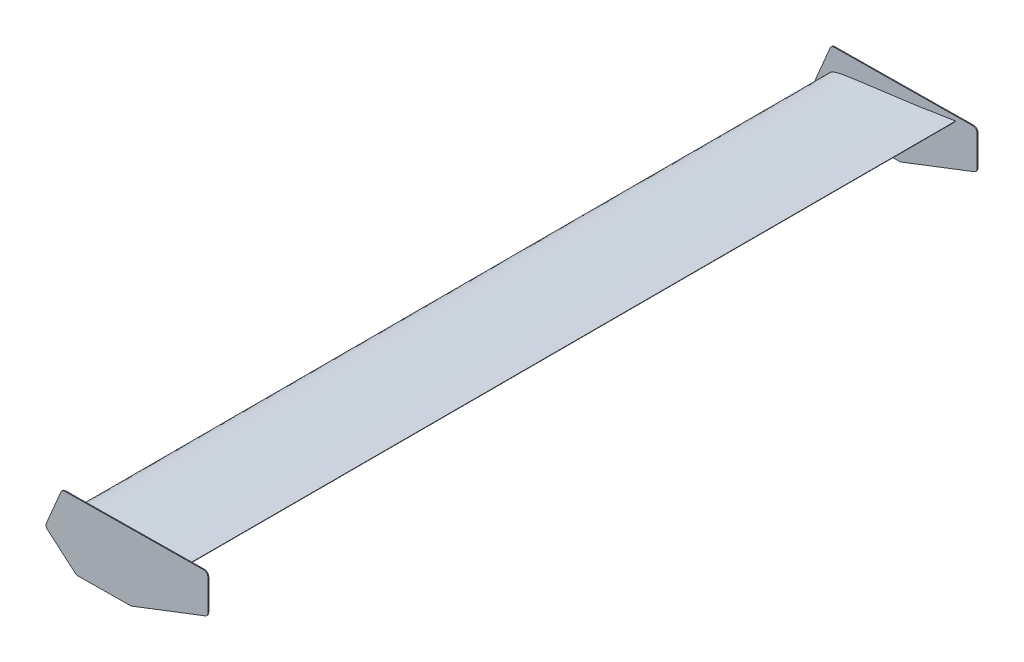
from build123d import *

# Parameters (mm, degrees)
REAR_WING_DEPTH              = 900
ENDPLATE_DEPTH               = 1
ENDPLATE_FILLET_R            = 10
ENDPLATE_FILLET_OF_MIRROR3_R = 10


with BuildPart() as part:
    # AirfoilSketch → Rear Wing (new, symmetric)
    with BuildSketch(Plane.XY):
        with BuildLine():
            Line((295.442575552, 52.09449732), (295.577022422, 51.326171843))
            add(Edge.make_bspline(
                [(295.577022422, 51.326171843), (290.891307166, 49.125863165), (281.542489297, 44.735864208), (262.727569494, 36.435906063), (239.075022797, 26.764238403), (210.421609353, 16.296267249), (181.624153974, 6.78650927), (152.592609753, -1.48249307), (123.359896769, -8.586697214), (98.677588602, -12.925891398), (78.728820396, -15.011295498), (63.611934373, -15.80542888), (48.313855434, -15.752522226), (35.463538652, -14.718103531), (25.049621623, -13.224653078), (17.090309366, -11.487207724), (10.177698047, -9.311573144), (3.988918794, -6.34517133), (-1.90572151, -0.864008687), (2.417566099, 4.873248607), (7.36001883, 7.693238109), (13.417421507, 10.072827448), (20.72189235, 12.021947419), (30.503324848, 14.208402507), (42.829451238, 16.329747473), (57.68063797, 18.502286025), (72.586822119, 20.299113186), (92.448783551, 22.825093662), (117.277393969, 25.951179332), (147.028226768, 30.012914081), (176.791016388, 33.950396789), (206.524649131, 38.071154207), (236.212058613, 42.470007184), (260.908662249, 46.387409089), (280.654798818, 49.576550662), (290.51340536, 51.255196874), (295.442575552, 52.09449732)],
                knots=[0, 0, 0, 0, 0.025304886, 0.050487653, 0.100520433, 0.150190716, 0.199586607, 0.248740009, 0.297715539, 0.346600594, 0.371102737, 0.395726297, 0.420570145, 0.445825119, 0.458702216, 0.471919982, 0.485786003, 0.493461051, 0.506863029, 0.51614777, 0.522766003, 0.535269014, 0.547551134, 0.559786371, 0.584228898, 0.60868081, 0.633151284, 0.657621757, 0.706558114, 0.75548187, 0.804405627, 0.853320224, 0.902221408, 0.951113136, 0.975557228, 1, 1, 1, 1], degree=3))
        make_face()
    extrude(amount=REAR_WING_DEPTH, both=True)

    # Endplate Sketch → Endplate (add, symmetric)
    with BuildSketch(Plane.XY.offset(900)):
        Polygon((4.198364617, 59.406656961), (-35.29092082, -33.850525596), (38.257501257, -96.733844985), (166.27509038, -95.421105135), (345.667321655, -26.31860721), (345.667321655, 62.908206322), align=None)
    endplate = extrude(amount=ENDPLATE_DEPTH, both=True)

    # Endplate Fillet
    endplate_fillet_edges = [part.edges().sort_by_distance(p)[0] for p in [
        (345.667321655, 62.908206322, 900),
        (4.198364617, 59.406656961, 900),
        (-35.29092082, -33.850525596, 900),
        (38.257501257, -96.733844985, 900),
        (166.27509038, -95.421105135, 900),
        (345.667321655, -26.31860721, 900),
    ]]
    fillet(endplate_fillet_edges, radius=ENDPLATE_FILLET_R)

    # Mirror3: Endplate across plane
    add(endplate.mirror(Plane.XY))

    # Endplate Fillet of Mirror3
    endplate_fillet_of_mirror3_edges = [part.edges().sort_by_distance(p)[0] for p in [
        (345.667321655, 62.908206322, -900),
        (4.198364617, 59.406656961, -900),
        (-35.29092082, -33.850525596, -900),
        (38.257501257, -96.733844985, -900),
        (166.27509038, -95.421105135, -900),
        (345.667321655, -26.31860721, -900),
    ]]
    fillet(endplate_fillet_of_mirror3_edges, radius=ENDPLATE_FILLET_OF_MIRROR3_R)


solid = part.part
